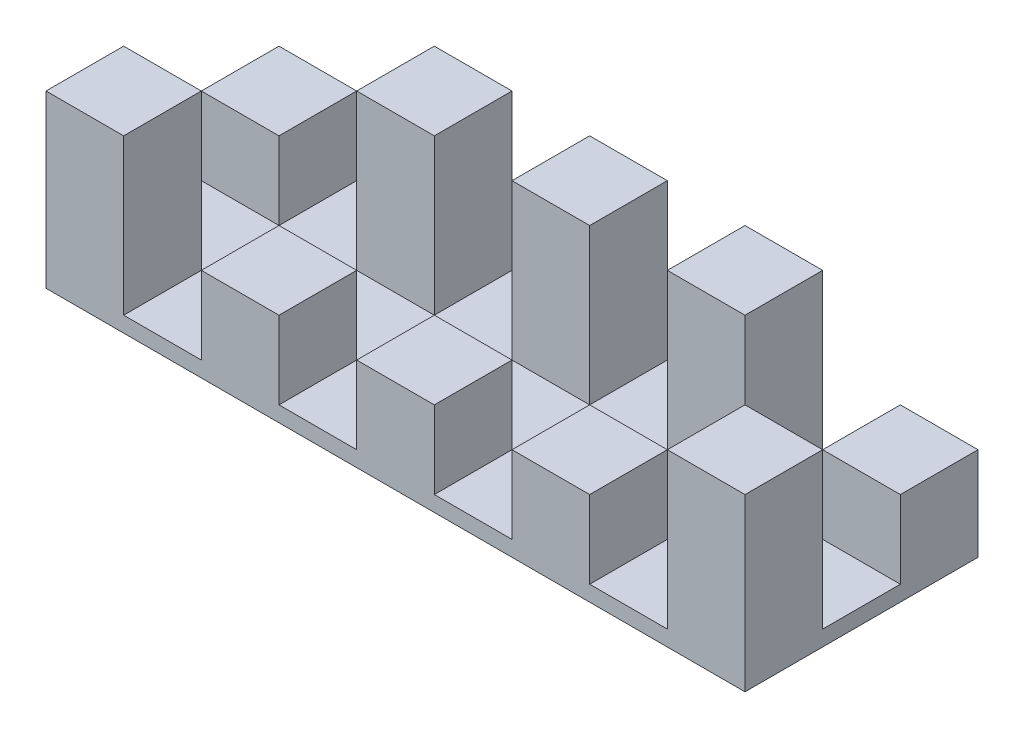
from build123d import *

# Parameters (mm, degrees)
SKETCH1_W           = 11430
SKETCH1_H           = 3810
BOSS_EXTRUDE2_DEPTH = 254
SKETCH2_W           = 1270
SKETCH2_H           = 1270
BOSS_EXTRUDE6_DEPTH = 1270
SKETCH2_5_W         = 1270
SKETCH2_5_H         = 1270
BOSS_EXTRUDE7_DEPTH = 2540


with BuildPart() as part:
    # Sketch1 → Boss-Extrude2 (new body)
    with BuildSketch(Plane(origin=(0, 0, 0), x_dir=(1, 0, 0), z_dir=(0, 1, 0))):
        with Locations((5715, 1905)):
            Rectangle(SKETCH1_W, SKETCH1_H)
    extrude(amount=BOSS_EXTRUDE2_DEPTH)

    # Sketch2 → Boss-Extrude6 (add)
    with BuildSketch(Plane(origin=(0, 254, 0), x_dir=(1, 0, 0), z_dir=(0, 1, 0))):
        with Locations((3175, 635)):
            Rectangle(SKETCH2_W, SKETCH2_H)
        with Locations((5715, 635)):
            Rectangle(SKETCH2_W, SKETCH2_H)
        with Locations((8255, 635)):
            Rectangle(SKETCH2_W, SKETCH2_H)
        with Locations((635, 3175)):
            Rectangle(SKETCH2_W, SKETCH2_H)
        with Locations((10795, 3175)):
            Rectangle(SKETCH2_W, SKETCH2_H)
    extrude(amount=BOSS_EXTRUDE6_DEPTH)

    # Sketch2<5> → Boss-Extrude7 (add)
    with BuildSketch(Plane(origin=(0, 254, 0), x_dir=(1, 0, 0), z_dir=(0, 1, 0))):
        with Locations((635, 635)):
            Rectangle(SKETCH2_5_W, SKETCH2_5_H)
        with Locations((10795, 635)):
            Rectangle(SKETCH2_5_W, SKETCH2_5_H)
        with Locations((3175, 3175)):
            Rectangle(SKETCH2_5_W, SKETCH2_5_H)
        with Locations((5715, 3175)):
            Rectangle(SKETCH2_5_W, SKETCH2_5_H)
        with Locations((8255, 3175)):
            Rectangle(SKETCH2_5_W, SKETCH2_5_H)
    extrude(amount=BOSS_EXTRUDE7_DEPTH)


solid = part.part
